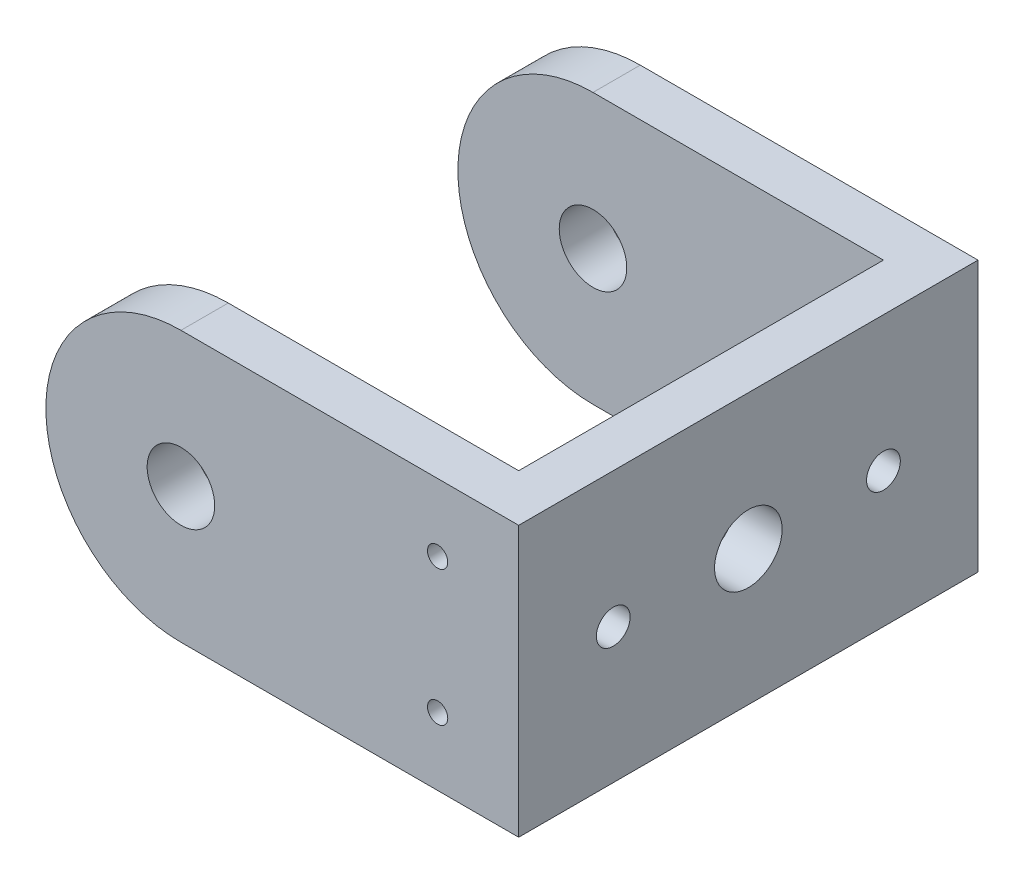
from build123d import *

# Parameters (mm, degrees)
SKETCH_1_R          = 5
EXTRUDE_1_DEPTH     = 68
SKETCH_2_W          = 68.768815545
SKETCH_2_H          = 54
CUT_EXTRUDE_1_DEPTH = 106.470374987
SKETCH_3_R          = 5
SKETCH_3_R_2        = 2.5
CUT_EXTRUDE_2_DEPTH = 106.470374987
SKETCH_4_R          = 1.5
CUT_EXTRUDE_3_DEPTH = 106.470374987


with BuildPart() as part:
    # ｽｹｯﾁ1 → ﾎﾞｽ - 押し出し1 (new body)
    with BuildSketch(Plane.XY):
        with BuildLine():
            Line((0, 0), (0, -40))
            Line((0, -40), (-50, -40))
            ThreePointArc((-50, -40), (-70, -20), (-50, 0))
            Line((-50, 0), (0, 0))
        make_face()
        with Locations((-50, -20)):
            Circle(SKETCH_1_R, mode=Mode.SUBTRACT)
    extrude(amount=EXTRUDE_1_DEPTH)

    # ｽｹｯﾁ2 → ｶｯﾄ - 押し出し1 (cut, through all)
    with BuildSketch(Plane(origin=(0, 0, 0), x_dir=(1, 0, 0), z_dir=(0, 1, 0))):
        with Locations((-41.384407773, -34)):
            Rectangle(SKETCH_2_W, SKETCH_2_H)
    extrude(amount=-CUT_EXTRUDE_1_DEPTH, mode=Mode.SUBTRACT)

    # ｽｹｯﾁ3 → ｶｯﾄ - 押し出し2 (cut, through all)
    with BuildSketch(Plane(origin=(0, 0, 0), x_dir=(0, 0, -1), z_dir=(1, 0, 0))):
        with Locations(Location((-34, -20, 0), (0, 0, 90))):
            Circle(SKETCH_3_R)
        with Locations(Location((-54, -20, 0), (0, 0, 90))):
            Circle(SKETCH_3_R_2)
        with Locations((-14, -20)):
            Circle(SKETCH_3_R_2)
    extrude(amount=-CUT_EXTRUDE_2_DEPTH, mode=Mode.SUBTRACT)

    # ｽｹｯﾁ4 → ｶｯﾄ - 押し出し3 (cut, through all)
    with BuildSketch(Plane(origin=(0, 0, 0), x_dir=(-1, 0, 0), z_dir=(0, 0, -1))):
        with Locations((12, -10)):
            Circle(SKETCH_4_R)
        with Locations(Location((12, -30, 0), (0, 0, 180))):
            Circle(SKETCH_4_R)
    extrude(amount=-CUT_EXTRUDE_3_DEPTH, mode=Mode.SUBTRACT)


solid = part.part
